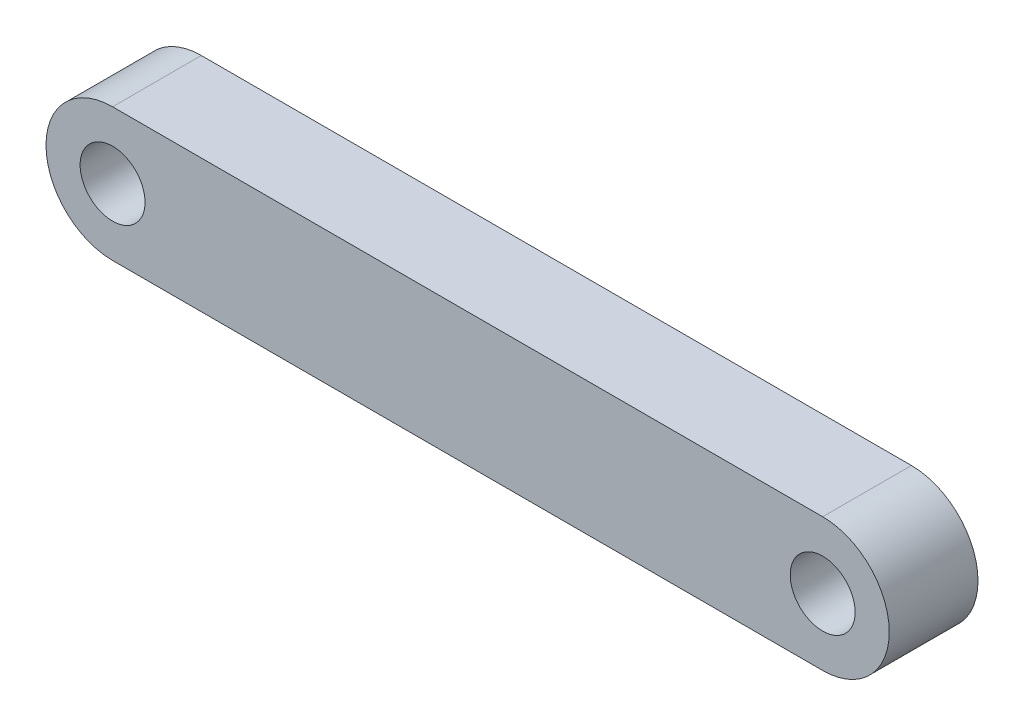
from build123d import *

# Parameters (mm, degrees)
SKETCH1_R           = 3.6576
BOSS_EXTRUDE1_DEPTH = 10


with BuildPart() as part:
    # Sketch1 → Boss-Extrude1 (new body)
    with BuildSketch(Plane.XY):
        with BuildLine():
            Line((0, 7.5), (80, 7.5))
            ThreePointArc((80, 7.5), (87.5, 0), (80, -7.5))
            Line((80, -7.5), (0, -7.5))
            ThreePointArc((0, -7.5), (-7.5, 0), (0, 7.5))
        make_face()
        Circle(SKETCH1_R, mode=Mode.SUBTRACT)
        with Locations((80, 0)):
            Circle(SKETCH1_R, mode=Mode.SUBTRACT)
    extrude(amount=BOSS_EXTRUDE1_DEPTH)


solid = part.part
